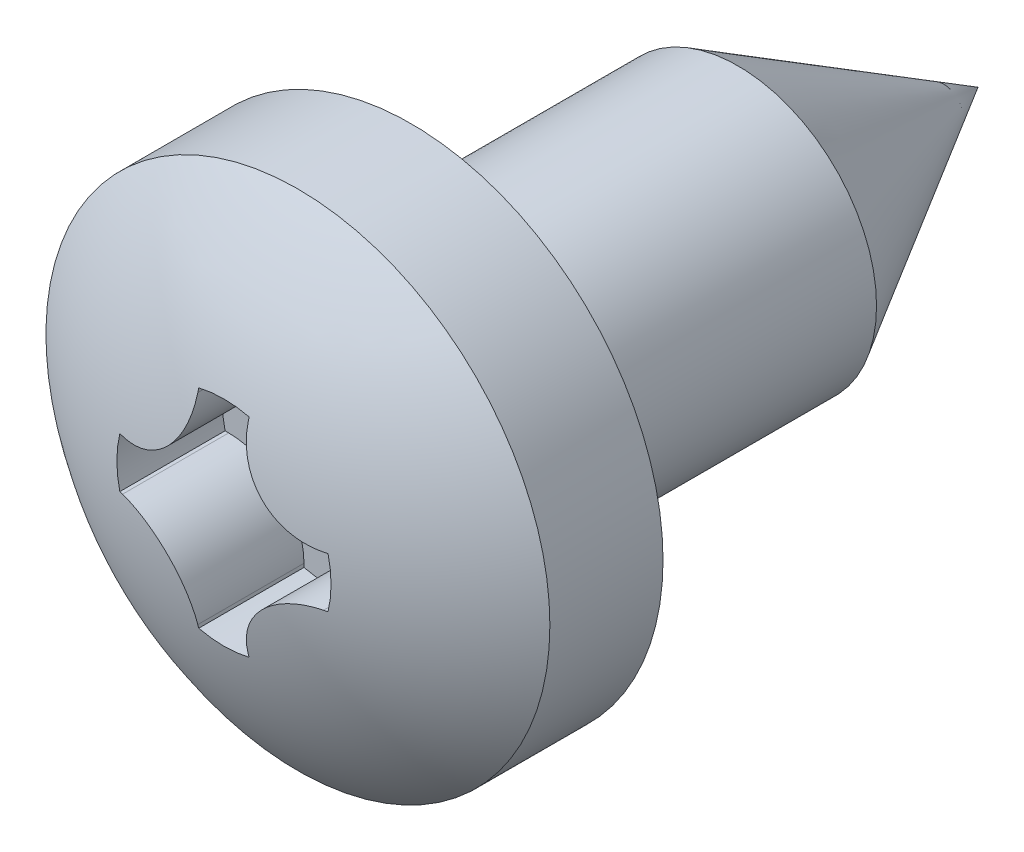
from build123d import *

# Parameters (mm, degrees)
CUT_EXTRUDE_2_DEPTH = 0.95
FILLET_1_R          = 0.1


with BuildPart() as part:
    # 草图8 → Revolve 1380 (revolve)
    with BuildSketch(Plane(origin=(0, 0, 0), x_dir=(0, 0, -1), z_dir=(1, 0, 0)), mode=Mode.PRIVATE) as revolve_1380_sk:
        with BuildLine():
            Line((0, 0), (-6.1, 0))
            ThreePointArc((-6.1, 0), (-5.919403703, 1.059811908), (-5.397999199, 2))
            Line((-5.397999199, 2), (-4.5, 2))
            Line((-4.5, 2), (-4.5, 1.1))
            Line((-4.5, 1.1), (-1.905255888, 1.1))
            Line((-1.905255888, 1.1), (0, 0))
        make_face()
    revolve(revolve_1380_sk.sketch.rotate(Axis((0, 0, 11.71), (0, 0, -1)), 90), axis=Axis((0, 0, 11.71), (0, 0, -1)))

    # 草图7 → 切除-拉伸2 (cut)
    with BuildSketch(Plane.XY.offset(6.1)):
        with BuildLine():
            Line((0.2, 0.826135582), (0.2, 0.797500009))
            ThreePointArc((0.2, 0.797500009), (0.375003701, 0.375003701), (0.797500009, 0.2))
            Line((0.797500009, 0.2), (0.826135582, 0.2))
            ThreePointArc((0.826135582, 0.2), (0.85, 0), (0.826135582, -0.2))
            Line((0.826135582, -0.2), (0.797500009, -0.2))
            ThreePointArc((0.797500009, -0.2), (0.375003701, -0.375003701), (0.2, -0.797500009))
            Line((0.2, -0.797500009), (0.2, -0.826135582))
            ThreePointArc((0.2, -0.826135582), (0, -0.85), (-0.2, -0.826135582))
            Line((-0.2, -0.826135582), (-0.2, -0.797500009))
            ThreePointArc((-0.2, -0.797500009), (-0.375003701, -0.375003701), (-0.797500009, -0.2))
            Line((-0.797500009, -0.2), (-0.826135582, -0.2))
            ThreePointArc((-0.826135582, -0.2), (-0.85, 0), (-0.826135582, 0.2))
            Line((-0.826135582, 0.2), (-0.797500009, 0.2))
            ThreePointArc((-0.797500009, 0.2), (-0.375003701, 0.375003701), (-0.2, 0.797500009))
            Line((-0.2, 0.797500009), (-0.2, 0.826135582))
            ThreePointArc((-0.2, 0.826135582), (0, 0.85), (0.2, 0.826135582))
        make_face()
    extrude(amount=-CUT_EXTRUDE_2_DEPTH, mode=Mode.SUBTRACT)

    # 圆角1
    fillet_1_edges = [part.edges().sort_by_distance(p)[0] for p in [
        (-1.1, 0, 4.5),
    ]]
    fillet(fillet_1_edges, radius=FILLET_1_R)


solid = part.part
